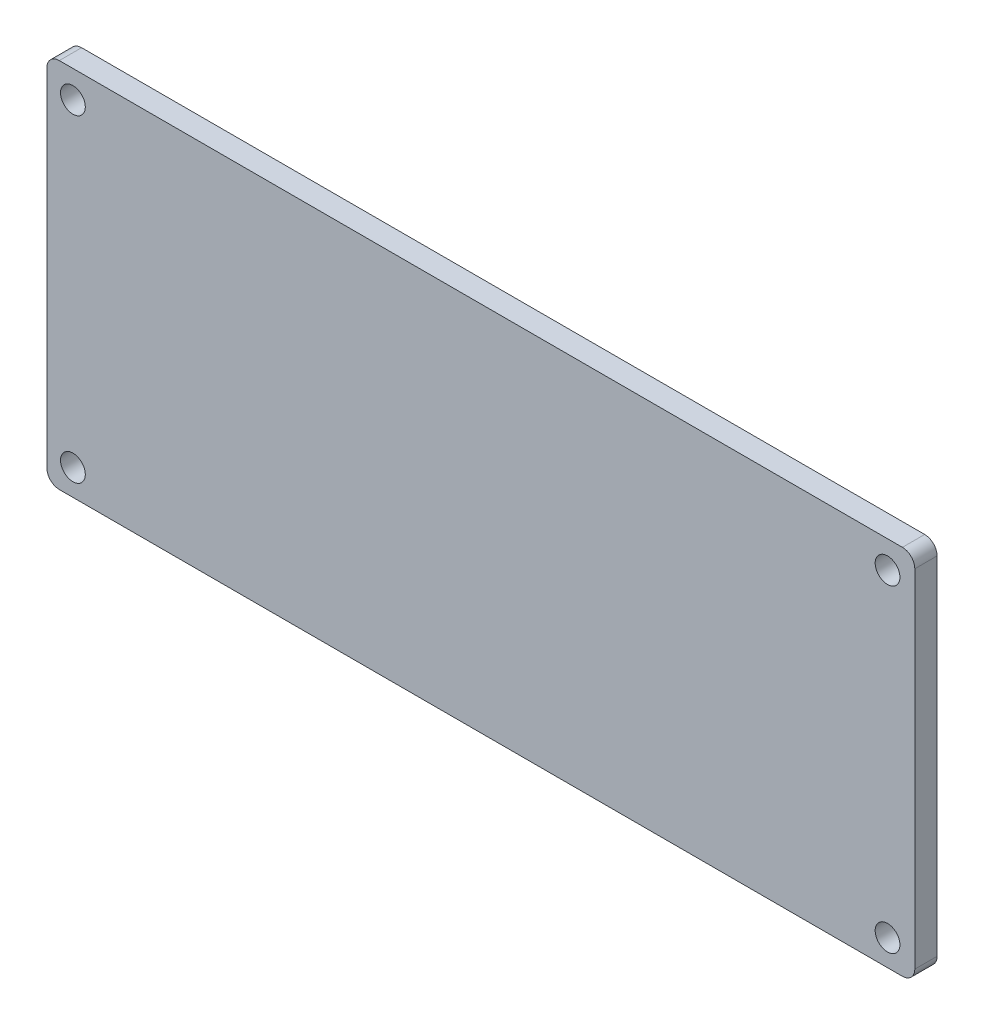
from build123d import *

# Parameters (mm, degrees)
SKETCH_1_W          = 70.08
SKETCH_1_H          = 30
EXTRUDE_1_DEPTH     = 1.8
FILLET_1_R          = 1
SKETCH_2_R          = 1
CUT_EXTRUDE_1_DEPTH = 1.8


with BuildPart() as part:
    # 草圖1 → 填料-伸長1 (new body)
    with BuildSketch(Plane.XY):
        with Locations((0.612329394, 8.056073211)):
            Rectangle(SKETCH_1_W, SKETCH_1_H)
    extrude(amount=EXTRUDE_1_DEPTH)

    # 圓角1
    fillet_1_edges = [part.edges().sort_by_distance(p)[0] for p in [
        (-34.427670606, 23.056073211, 0.9),
        (35.652329394, 23.056073211, 0.9),
        (35.652329394, -6.943926789, 0.9),
        (-34.427670606, -6.943926789, 0.9),
    ]]
    fillet(fillet_1_edges, radius=FILLET_1_R)

    # 草圖2 → 除料-伸長1 (cut)
    with BuildSketch(Plane.XY.offset(1.8)):
        with Locations((-32.327670606, 20.856073211)):
            Circle(SKETCH_2_R)
        with Locations((-32.327670606, -4.843926789)):
            Circle(SKETCH_2_R)
        with Locations((33.452329394, -4.843926789)):
            Circle(SKETCH_2_R)
        with Locations((33.452329394, 20.856073211)):
            Circle(SKETCH_2_R)
    extrude(amount=-CUT_EXTRUDE_1_DEPTH, mode=Mode.SUBTRACT)


solid = part.part
